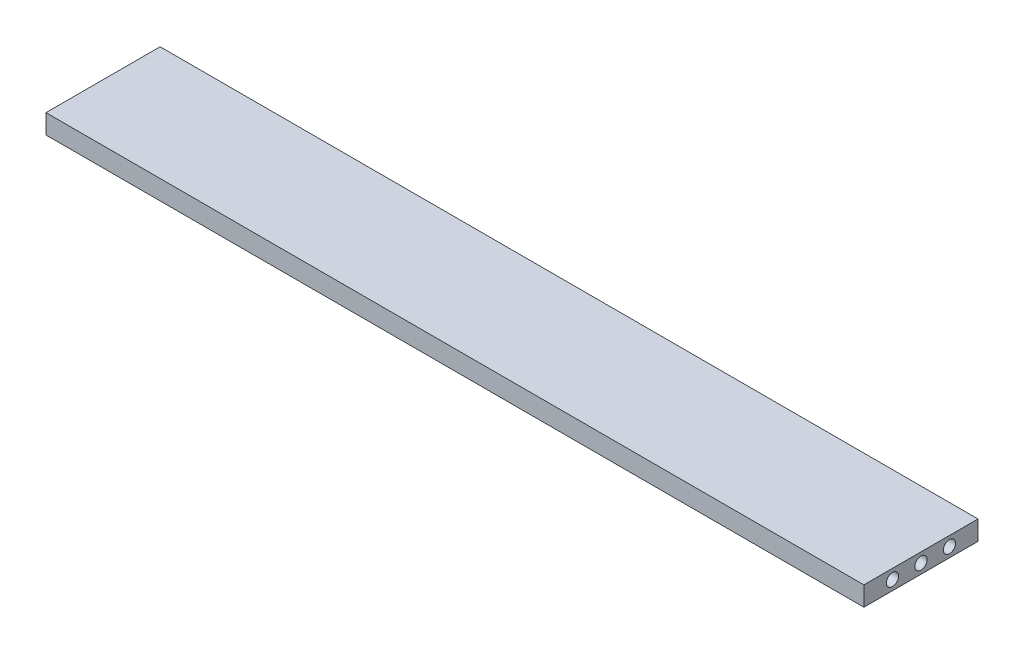
from build123d import *

# Parameters (mm, degrees)
ESBO_O1_W                = 401.43
ESBO_O1_H                = 56
RESSALTO_EXTRUS_O1_DEPTH = 9.525
ESBO_O2_R                = 3
FUROS_IZQ_DEPTH          = 30
ESBO_O3_R                = 3
FUROS_DER_DEPTH          = 30


with BuildPart() as part:
    # Esboço1 → Ressalto-extrusão1 (new body)
    with BuildSketch(Plane(origin=(0, 0, 0), x_dir=(1, 0, 0), z_dir=(0, 1, 0))):
        Rectangle(ESBO_O1_W, ESBO_O1_H)
    extrude(amount=RESSALTO_EXTRUS_O1_DEPTH)

    # Esboço2 → Furos Izq (cut)
    with BuildSketch(Plane.ZY.offset(200.715)):
        with Locations((14, 4.76)):
            Circle(ESBO_O2_R)
        with Locations((0, 4.76)):
            Circle(ESBO_O2_R)
        with Locations((-14, 4.76)):
            Circle(ESBO_O2_R)
    extrude(amount=-FUROS_IZQ_DEPTH, mode=Mode.SUBTRACT)

    # Esboço3 → Furos Der (cut)
    with BuildSketch(Plane(origin=(200.715, 0, 0), x_dir=(0, 0, -1), z_dir=(1, 0, 0))):
        with Locations((14, 4.765)):
            Circle(ESBO_O3_R)
        with Locations((0, 4.765)):
            Circle(ESBO_O3_R)
        with Locations((-14, 4.765)):
            Circle(ESBO_O3_R)
    extrude(amount=-FUROS_DER_DEPTH, mode=Mode.SUBTRACT)


solid = part.part
